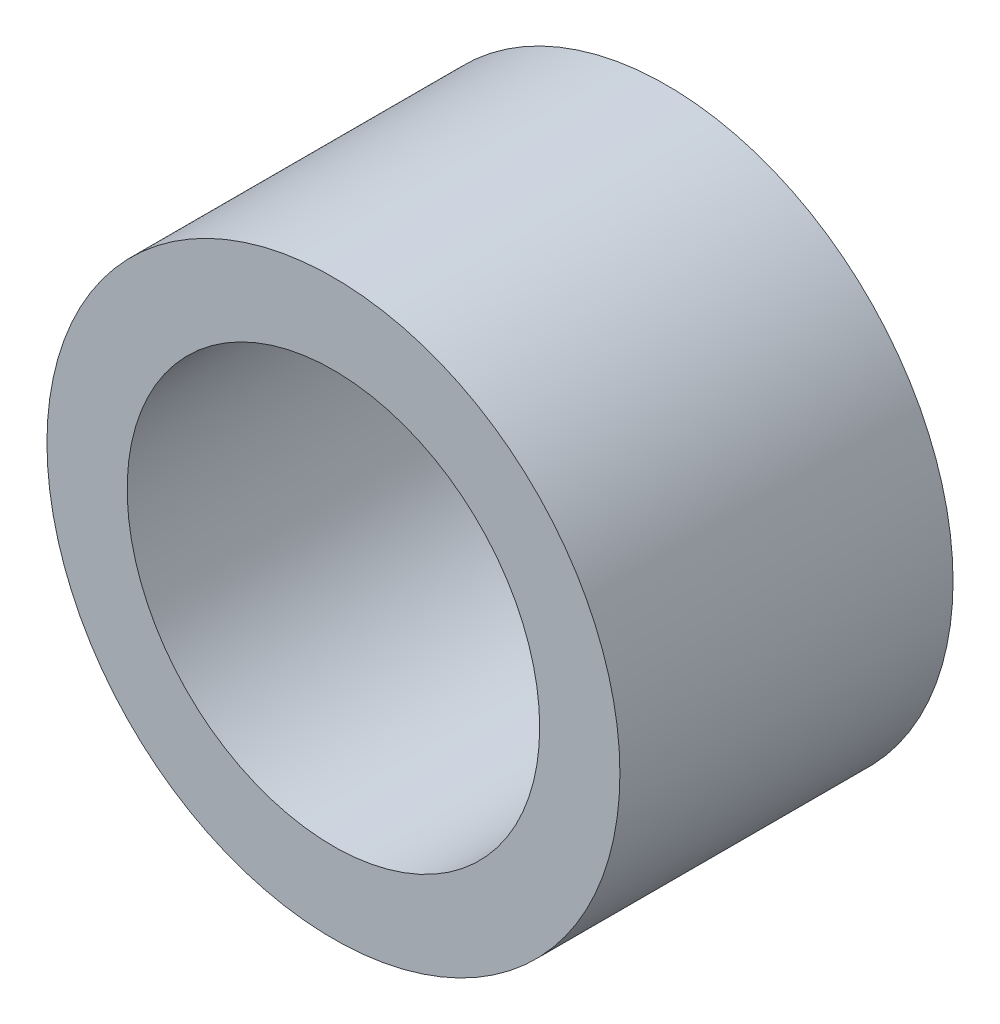
from build123d import *

# Parameters (mm, degrees)
SKETCH1_W = 5.1689
SKETCH1_H = 1.2446


with BuildPart() as part:
    # Sketch1 → Revolve1 (revolve)
    with BuildSketch(Plane(origin=(0, 0, 0), x_dir=(0, 0, -1), z_dir=(1, 0, 0)), mode=Mode.PRIVATE) as revolve1_sk:
        with Locations((2.58445, 3.8227)):
            Rectangle(SKETCH1_W, SKETCH1_H)
    revolve(revolve1_sk.sketch.rotate(Axis((0, 0, 0), (0, 0, -1)), 90), axis=Axis((0, 0, 0), (0, 0, -1)))


solid = part.part
